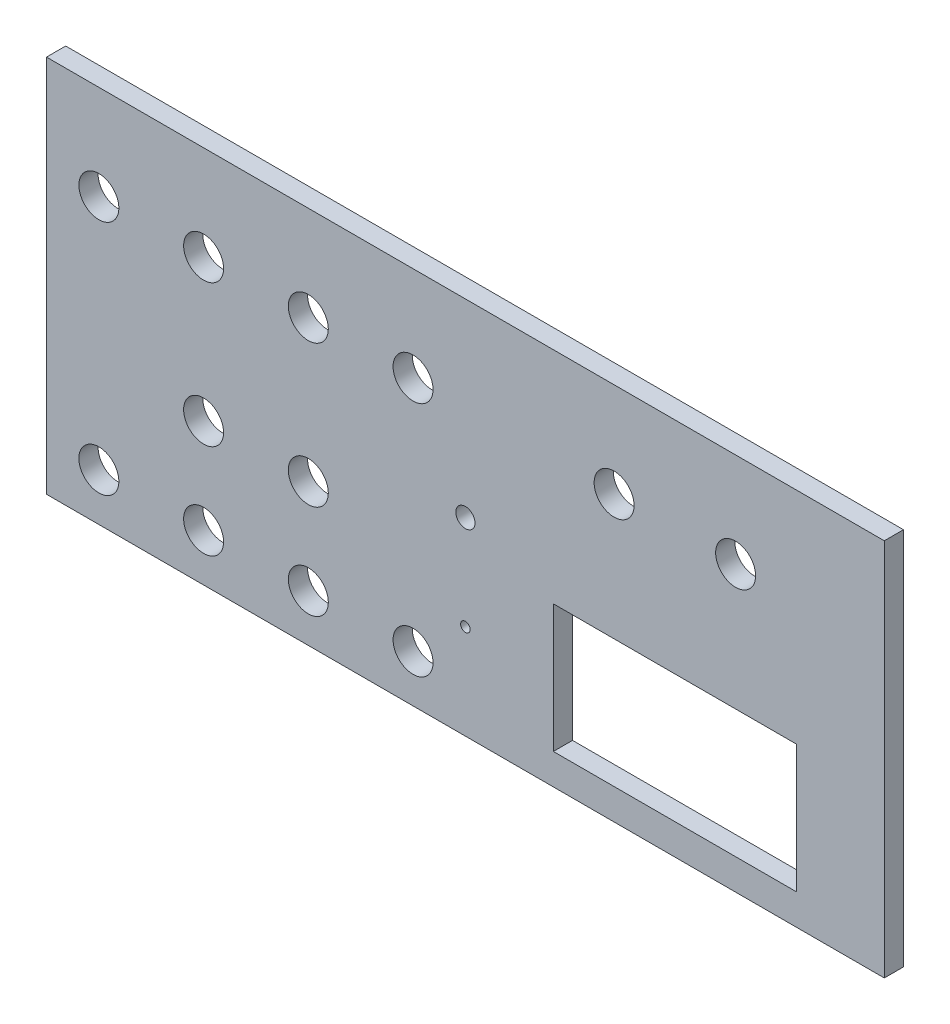
from build123d import *

# Parameters (mm, degrees)
ESQUISSE1_W             = 262
ESQUISSE1_H             = 118.414906094
BOSS_EXTRU_1_DEPTH      = 6
ENL_V_MAT_EXTRU_1_REACH = 281.659
ESQUISSE2_R             = 6.25
ESQUISSE2_W             = 76
ESQUISSE2_H             = 40
ENL_V_MAT_EXTRU_2_REACH = 281.659
ESQUISSE3_R             = 3
ESQUISSE3_R_2           = 1.5
ENL_V_MAT_EXTRU_3_REACH = 281.659
ESQUISSE4_R             = 6.25


with BuildPart() as part:
    # Esquisse1 → Boss.-Extru.1 (new body)
    with BuildSketch(Plane.XY):
        with Locations((-125, -53.207453047)):
            Rectangle(ESQUISSE1_W, ESQUISSE1_H)
    extrude(amount=BOSS_EXTRU_1_DEPTH)

    # Esquisse2 → Enlèv. mat.-Extru.1 (cut, up to next)
    with BuildSketch(Plane.XY.offset(6), mode=Mode.PRIVATE) as enl_v_mat_extru_1_sk1:
        with Locations((-40.5, -23.603726524)):
            Circle(ESQUISSE2_R)
    enl_v_mat_extru_1_tool1 = extrude(enl_v_mat_extru_1_sk1.sketch, amount=-ENL_V_MAT_EXTRU_1_REACH, mode=Mode.PRIVATE) & part.part
    # Esquisse2 → Enlèv. mat.-Extru.1 (cut, up to next)
    with BuildSketch(Plane.XY.offset(6), mode=Mode.PRIVATE) as enl_v_mat_extru_1_sk2:
        with Locations((-78.5, -23.603726524)):
            Circle(ESQUISSE2_R)
    enl_v_mat_extru_1_tool2 = extrude(enl_v_mat_extru_1_sk2.sketch, amount=-ENL_V_MAT_EXTRU_1_REACH, mode=Mode.PRIVATE) & part.part
    # Esquisse2 → Enlèv. mat.-Extru.1 (cut, up to next)
    with BuildSketch(Plane.XY.offset(6), mode=Mode.PRIVATE) as enl_v_mat_extru_1_sk3:
        with Locations((-59.5, -82.811179571)):
            Rectangle(ESQUISSE2_W, ESQUISSE2_H)
    enl_v_mat_extru_1_tool3 = extrude(enl_v_mat_extru_1_sk3.sketch, amount=-ENL_V_MAT_EXTRU_1_REACH, mode=Mode.PRIVATE) & part.part
    add(enl_v_mat_extru_1_tool1.solids().sort_by_distance((-40.5, -23.603727, 6))[0], mode=Mode.SUBTRACT)
    add(enl_v_mat_extru_1_tool2.solids().sort_by_distance((-78.5, -23.603727, 6))[0], mode=Mode.SUBTRACT)
    add(enl_v_mat_extru_1_tool3.solids().sort_by_distance((-59.5, -82.81118, 6))[0], mode=Mode.SUBTRACT)

    # Esquisse3 → Enlèv. mat.-Extru.2 (cut, up to next)
    with BuildSketch(Plane.XY.offset(6), mode=Mode.PRIVATE) as enl_v_mat_extru_2_sk1:
        with Locations((-125, -53.207453047)):
            Circle(ESQUISSE3_R)
    enl_v_mat_extru_2_tool1 = extrude(enl_v_mat_extru_2_sk1.sketch, amount=-ENL_V_MAT_EXTRU_2_REACH, mode=Mode.PRIVATE) & part.part
    # Esquisse3 → Enlèv. mat.-Extru.2 (cut, up to next)
    with BuildSketch(Plane.XY.offset(6), mode=Mode.PRIVATE) as enl_v_mat_extru_2_sk2:
        with Locations((-125, -82.811179571)):
            Circle(ESQUISSE3_R_2)
    enl_v_mat_extru_2_tool2 = extrude(enl_v_mat_extru_2_sk2.sketch, amount=-ENL_V_MAT_EXTRU_2_REACH, mode=Mode.PRIVATE) & part.part
    add(enl_v_mat_extru_2_tool1.solids().sort_by_distance((-125, -53.207453, 6))[0], mode=Mode.SUBTRACT)
    add(enl_v_mat_extru_2_tool2.solids().sort_by_distance((-125, -82.81118, 6))[0], mode=Mode.SUBTRACT)

    # Esquisse4 → Enlèv. mat.-Extru.3 (cut, up to next)
    with BuildSketch(Plane.XY.offset(6), mode=Mode.PRIVATE) as enl_v_mat_extru_3_sk1:
        with Locations((-141.375, -97.613042832)):
            Circle(ESQUISSE4_R)
    enl_v_mat_extru_3_tool1 = extrude(enl_v_mat_extru_3_sk1.sketch, amount=-ENL_V_MAT_EXTRU_3_REACH, mode=Mode.PRIVATE) & part.part
    # Esquisse4 → Enlèv. mat.-Extru.3 (cut, up to next)
    with BuildSketch(Plane.XY.offset(6), mode=Mode.PRIVATE) as enl_v_mat_extru_3_sk2:
        with Locations((-174.125, -97.613042832)):
            Circle(ESQUISSE4_R)
    enl_v_mat_extru_3_tool2 = extrude(enl_v_mat_extru_3_sk2.sketch, amount=-ENL_V_MAT_EXTRU_3_REACH, mode=Mode.PRIVATE) & part.part
    # Esquisse4 → Enlèv. mat.-Extru.3 (cut, up to next)
    with BuildSketch(Plane.XY.offset(6), mode=Mode.PRIVATE) as enl_v_mat_extru_3_sk3:
        with Locations((-206.875, -97.613042832)):
            Circle(ESQUISSE4_R)
    enl_v_mat_extru_3_tool3 = extrude(enl_v_mat_extru_3_sk3.sketch, amount=-ENL_V_MAT_EXTRU_3_REACH, mode=Mode.PRIVATE) & part.part
    # Esquisse4 → Enlèv. mat.-Extru.3 (cut, up to next)
    with BuildSketch(Plane.XY.offset(6), mode=Mode.PRIVATE) as enl_v_mat_extru_3_sk4:
        with Locations((-239.625, -97.613042832)):
            Circle(ESQUISSE4_R)
    enl_v_mat_extru_3_tool4 = extrude(enl_v_mat_extru_3_sk4.sketch, amount=-ENL_V_MAT_EXTRU_3_REACH, mode=Mode.PRIVATE) & part.part
    # Esquisse4 → Enlèv. mat.-Extru.3 (cut, up to next)
    with BuildSketch(Plane.XY.offset(6), mode=Mode.PRIVATE) as enl_v_mat_extru_3_sk5:
        with Locations((-174.125, -68.009316309)):
            Circle(ESQUISSE4_R)
    enl_v_mat_extru_3_tool5 = extrude(enl_v_mat_extru_3_sk5.sketch, amount=-ENL_V_MAT_EXTRU_3_REACH, mode=Mode.PRIVATE) & part.part
    # Esquisse4 → Enlèv. mat.-Extru.3 (cut, up to next)
    with BuildSketch(Plane.XY.offset(6), mode=Mode.PRIVATE) as enl_v_mat_extru_3_sk6:
        with Locations((-206.875, -68.009316309)):
            Circle(ESQUISSE4_R)
    enl_v_mat_extru_3_tool6 = extrude(enl_v_mat_extru_3_sk6.sketch, amount=-ENL_V_MAT_EXTRU_3_REACH, mode=Mode.PRIVATE) & part.part
    # Esquisse4 → Enlèv. mat.-Extru.3 (cut, up to next)
    with BuildSketch(Plane.XY.offset(6), mode=Mode.PRIVATE) as enl_v_mat_extru_3_sk7:
        with Locations((-141.375, -23.603726524)):
            Circle(ESQUISSE4_R)
    enl_v_mat_extru_3_tool7 = extrude(enl_v_mat_extru_3_sk7.sketch, amount=-ENL_V_MAT_EXTRU_3_REACH, mode=Mode.PRIVATE) & part.part
    # Esquisse4 → Enlèv. mat.-Extru.3 (cut, up to next)
    with BuildSketch(Plane.XY.offset(6), mode=Mode.PRIVATE) as enl_v_mat_extru_3_sk8:
        with Locations((-174.125, -23.603726524)):
            Circle(ESQUISSE4_R)
    enl_v_mat_extru_3_tool8 = extrude(enl_v_mat_extru_3_sk8.sketch, amount=-ENL_V_MAT_EXTRU_3_REACH, mode=Mode.PRIVATE) & part.part
    # Esquisse4 → Enlèv. mat.-Extru.3 (cut, up to next)
    with BuildSketch(Plane.XY.offset(6), mode=Mode.PRIVATE) as enl_v_mat_extru_3_sk9:
        with Locations((-206.875, -23.603726524)):
            Circle(ESQUISSE4_R)
    enl_v_mat_extru_3_tool9 = extrude(enl_v_mat_extru_3_sk9.sketch, amount=-ENL_V_MAT_EXTRU_3_REACH, mode=Mode.PRIVATE) & part.part
    # Esquisse4 → Enlèv. mat.-Extru.3 (cut, up to next)
    with BuildSketch(Plane.XY.offset(6), mode=Mode.PRIVATE) as enl_v_mat_extru_3_sk10:
        with Locations((-239.625, -23.603726524)):
            Circle(ESQUISSE4_R)
    enl_v_mat_extru_3_tool10 = extrude(enl_v_mat_extru_3_sk10.sketch, amount=-ENL_V_MAT_EXTRU_3_REACH, mode=Mode.PRIVATE) & part.part
    add(enl_v_mat_extru_3_tool1.solids().sort_by_distance((-141.375, -97.613043, 6))[0], mode=Mode.SUBTRACT)
    add(enl_v_mat_extru_3_tool2.solids().sort_by_distance((-174.125, -97.613043, 6))[0], mode=Mode.SUBTRACT)
    add(enl_v_mat_extru_3_tool3.solids().sort_by_distance((-206.875, -97.613043, 6))[0], mode=Mode.SUBTRACT)
    add(enl_v_mat_extru_3_tool4.solids().sort_by_distance((-239.625, -97.613043, 6))[0], mode=Mode.SUBTRACT)
    add(enl_v_mat_extru_3_tool5.solids().sort_by_distance((-174.125, -68.009316, 6))[0], mode=Mode.SUBTRACT)
    add(enl_v_mat_extru_3_tool6.solids().sort_by_distance((-206.875, -68.009316, 6))[0], mode=Mode.SUBTRACT)
    add(enl_v_mat_extru_3_tool7.solids().sort_by_distance((-141.375, -23.603727, 6))[0], mode=Mode.SUBTRACT)
    add(enl_v_mat_extru_3_tool8.solids().sort_by_distance((-174.125, -23.603727, 6))[0], mode=Mode.SUBTRACT)
    add(enl_v_mat_extru_3_tool9.solids().sort_by_distance((-206.875, -23.603727, 6))[0], mode=Mode.SUBTRACT)
    add(enl_v_mat_extru_3_tool10.solids().sort_by_distance((-239.625, -23.603727, 6))[0], mode=Mode.SUBTRACT)


solid = part.part
